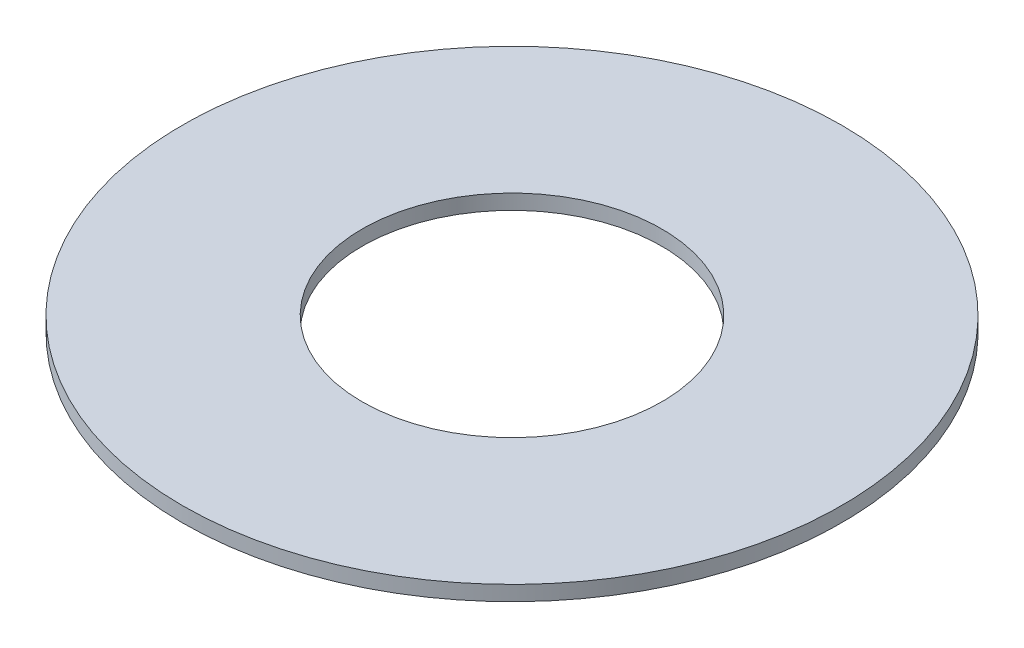
from build123d import *

# Parameters (mm, degrees)
SKETCH_1_R      = 22
SKETCH_1_R_2    = 10
EXTRUDE_1_DEPTH = 1


with BuildPart() as part:
    # Эскиз1 → Бобышка-Вытянуть1 (new body)
    with BuildSketch(Plane(origin=(0, 0, 0), x_dir=(1, 0, 0), z_dir=(0, 1, 0))):
        with Locations(Location((0, 0, 0), (0, 0, 270))):
            Circle(SKETCH_1_R)
        with Locations(Location((0, 0, 0), (0, 0, 270))):
            Circle(SKETCH_1_R_2, mode=Mode.SUBTRACT)
    extrude(amount=EXTRUDE_1_DEPTH)


solid = part.part
